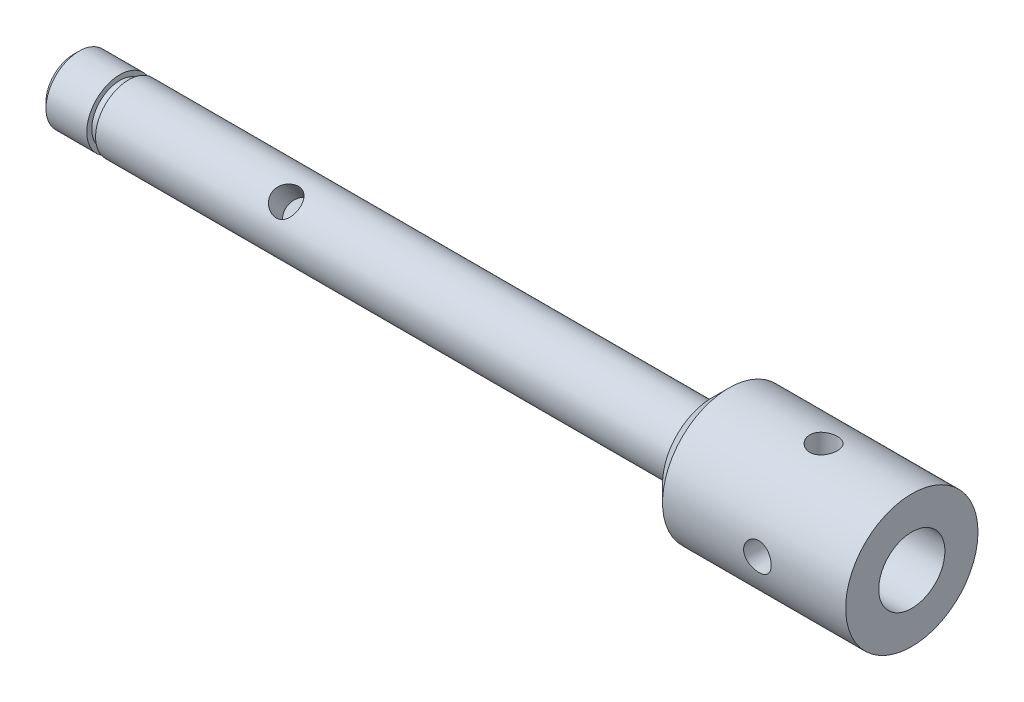
from build123d import *

# Parameters (mm, degrees)
CHAFL_N1_SIZE                                  = 0.5
PERFORADOR_PARA_ROSCAR_PARA_MACHO_DE_ROS_D     = 2.5
PERFORADOR_PARA_ROSCAR_PARA_MACHO_DE_ROS_DEPTH = 6
PERFORADOR_PARA_ROSCAR_PARA_MACHO_DE_ROS_TIP   = 0.751075774
CROQUIS12_W                                    = 1.25
CROQUIS12_H                                    = 6
TALADROS_DE_ESPIGA_DE_6_0MM1_D                 = 6
TALADROS_DE_ESPIGA_DE_6_0MM1_DEPTH             = 14
TALADROS_DE_ESPIGA_DE_6_0MM1_TIP               = 1.802581857
PERFORADOR_PARA_ROSCAR_PARA_MACHO_DE_3_D       = 2.5
PERFORADOR_PARA_ROSCAR_PARA_MACHO_DE_3_DEPTH   = 2.248924226
PERFORADOR_PARA_ROSCAR_PARA_MACHO_DE_3_TIP     = 0.751075774


with BuildPart() as part:
    # Croquis1 → Revolución1 (revolve)
    with BuildSketch(Plane(origin=(0, 0, 0), x_dir=(-1, 0, 0), z_dir=(0, 1, 0)), mode=Mode.PRIVATE) as revoluci_n1_sk:
        Polygon((-45.3, 3), (-45.3, 6), (-28.7, 6), (-27.2, 4.5), (-27.2, 3), (25.7, 3), (25.7, 2.55), (26.5, 2.55), (26.5, 3), (30.7, 3), (30.7, 0), (-30.7, 0), (-45.3, 0), align=None)
    revolve(revoluci_n1_sk.sketch.rotate(Axis((30.7, 0, 0), (-1, 0, 0)), 180), axis=Axis((30.7, 0, 0), (-1, 0, 0)))

    # Chaflán1
    chafl_n1_edges = [part.edges().sort_by_distance(p)[0] for p in [
        (-30.7, 0, 3),
    ]]
    chamfer(chafl_n1_edges, length=CHAFL_N1_SIZE)

    # Perforador para roscar para macho de ros
    with Locations(Plane(origin=(0, 6, -6), x_dir=(0, 0, 1), z_dir=(0, 1, 0))):
        with Locations((6, 37.3)):
            Hole(PERFORADOR_PARA_ROSCAR_PARA_MACHO_DE_ROS_D / 2, depth=PERFORADOR_PARA_ROSCAR_PARA_MACHO_DE_ROS_DEPTH)
            with Locations((0, 0, -(PERFORADOR_PARA_ROSCAR_PARA_MACHO_DE_ROS_DEPTH + PERFORADOR_PARA_ROSCAR_PARA_MACHO_DE_ROS_TIP / 2))):  # 118° drill point
                Cone(0, PERFORADOR_PARA_ROSCAR_PARA_MACHO_DE_ROS_D / 2, PERFORADOR_PARA_ROSCAR_PARA_MACHO_DE_ROS_TIP, mode=Mode.SUBTRACT)

    # Croquis12 → Perforador para roscar para macho de 2 (revolve, cut)
    with BuildSketch(Plane.YZ.offset(37.3)):
        with Locations((0.625, 3)):
            Rectangle(CROQUIS12_W, CROQUIS12_H)
    revolve(axis=Axis((37.3, 0, -6.35), (0, 0, 1)), mode=Mode.SUBTRACT)

    # Taladros de espiga de Ø6.0mm1
    with Locations(Plane.YZ.offset(45.3)):
        with Locations((0, 0)):
            Hole(TALADROS_DE_ESPIGA_DE_6_0MM1_D / 2, depth=TALADROS_DE_ESPIGA_DE_6_0MM1_DEPTH)
            with Locations((0, 0, -(TALADROS_DE_ESPIGA_DE_6_0MM1_DEPTH + TALADROS_DE_ESPIGA_DE_6_0MM1_TIP / 2))):  # 118° drill point
                Cone(0, TALADROS_DE_ESPIGA_DE_6_0MM1_D / 2, TALADROS_DE_ESPIGA_DE_6_0MM1_TIP, mode=Mode.SUBTRACT)

    # Perforador para roscar para macho de 3
    with Locations(Plane(origin=(-9.7, 2.417350066, 1.776631267), x_dir=(0, -0.592210422366, 0.805783355276), z_dir=(0, 0.805783355276, 0.592210422366))):
        with Locations((0, 0)):
            Hole(PERFORADOR_PARA_ROSCAR_PARA_MACHO_DE_3_D / 2, depth=PERFORADOR_PARA_ROSCAR_PARA_MACHO_DE_3_DEPTH)
            with Locations((0, 0, -(PERFORADOR_PARA_ROSCAR_PARA_MACHO_DE_3_DEPTH + PERFORADOR_PARA_ROSCAR_PARA_MACHO_DE_3_TIP / 2))):  # 118° drill point
                Cone(0, PERFORADOR_PARA_ROSCAR_PARA_MACHO_DE_3_D / 2, PERFORADOR_PARA_ROSCAR_PARA_MACHO_DE_3_TIP, mode=Mode.SUBTRACT)


solid = part.part
